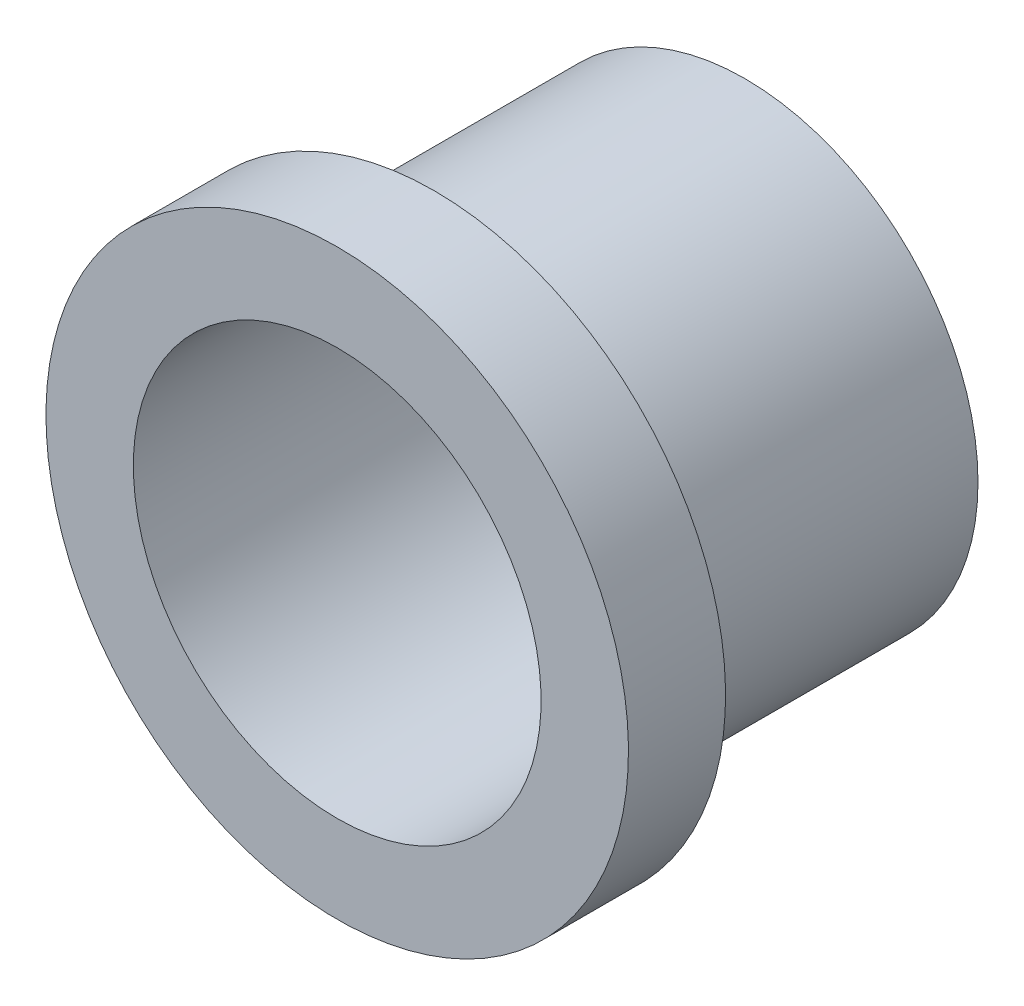
from build123d import *

# Parameters (mm, degrees)
SKETCH3_R          = 10.5
CUT_EXTRUDE1_DEPTH = 30.849623113


with BuildPart() as part:
    # Sketch2 → Revolve1 (revolve)
    with BuildSketch(Plane(origin=(0, 0, 0), x_dir=(0, 0, -1), z_dir=(1, 0, 0))):
        Polygon((10.5, 0), (10.5, 12), (-5.5, 12), (-5.5, 15), (-10.5, 15), (-10.5, 0), align=None)
    revolve(axis=Axis((0, 0, -10.5), (0, 0, 1)))

    # Sketch3 → Cut-Extrude1 (cut, through all)
    with BuildSketch(Plane(origin=(0, 0, -10.5), x_dir=(-1, 0, 0), z_dir=(0, 0, -1))):
        with Locations(Location((0, 0, 0), (0, 0, 90))):
            Circle(SKETCH3_R)
    extrude(amount=-CUT_EXTRUDE1_DEPTH, mode=Mode.SUBTRACT)


solid = part.part
